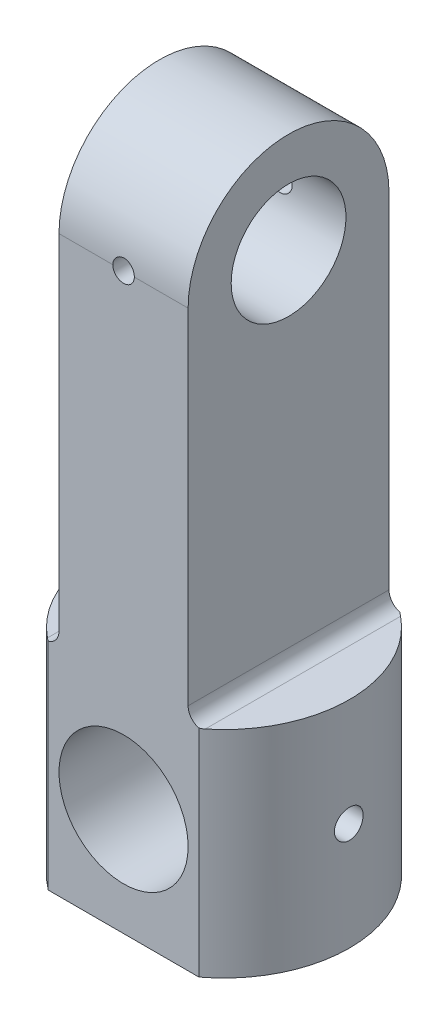
from build123d import *

# Parameters (mm, degrees)
SKETCH1_R               = 17.5
BOSS_EXTRUDE1_DEPTH     = 30
SKETCH2_W               = 18
SKETCH2_H               = 30.01666204
BOSS_EXTRUDE2_DEPTH     = 70
CUT_EXTRUDE1_DEPTH      = 104.01698889
CUT_EXTRUDE1_DEPTH_BACK = 104.01698889
CUT_EXTRUDE2_DEPTH      = 105.394683773
CUT_EXTRUDE2_DEPTH_BACK = 105.394683773
SKETCH4_R               = 8
CUT_EXTRUDE3_DEPTH      = 100.630567599
CUT_EXTRUDE3_DEPTH_BACK = 100.630567599
SKETCH6_R               = 9
FILLET1_R               = 2
CUT_EXTRUDE4_DEPTH      = 97.634621158
CUT_EXTRUDE4_DEPTH_BACK = 97.634621158
SKETCH7_R               = 2
CUT_EXTRUDE5_DEPTH      = 97.634621159
CUT_EXTRUDE5_DEPTH_BACK = 97.634621159
SKETCH8_R               = 1.5


with BuildPart() as part:
    # Sketch1 → Boss-Extrude1 (new body)
    with BuildSketch(Plane(origin=(0, 0, 0), x_dir=(1, 0, 0), z_dir=(0, 1, 0))):
        with Locations(Location((0, 0, 0), (0, 0, 270))):
            Circle(SKETCH1_R)
    extrude(amount=BOSS_EXTRUDE1_DEPTH)

    # Sketch2 → Boss-Extrude2 (add)
    with BuildSketch(Plane(origin=(0, 30, 0), x_dir=(1, 0, 0), z_dir=(0, 1, 0))):
        Rectangle(SKETCH2_W, SKETCH2_H)
    extrude(amount=BOSS_EXTRUDE2_DEPTH)

    # Sketch3 → Cut-Extrude1 (cut, two sides: drawn at the far end of the back side and taken through both)
    with BuildSketch(Plane.XZ.offset(-CUT_EXTRUDE1_DEPTH_BACK)):
        with BuildLine():
            Line((-10.5, -14), (10.5, -14))
            ThreePointArc((10.5, -14), (0, -17.5), (-10.5, -14))
        make_face()
        with BuildLine():
            Line((-10.5, 14), (10.5, 14))
            ThreePointArc((10.5, 14), (0, 17.5), (-10.5, 14))
        make_face()
    extrude(amount=CUT_EXTRUDE1_DEPTH + CUT_EXTRUDE1_DEPTH_BACK, mode=Mode.SUBTRACT)

    # Sketch4 → Cut-Extrude2 (cut, two sides: drawn at the far end of the back side and taken through both)
    with BuildSketch(Plane.ZY.offset(9).offset(-CUT_EXTRUDE2_DEPTH_BACK)):
        with Locations((0, 80)):
            Circle(SKETCH4_R)
        with BuildLine():
            Line((-14, 80), (-32.866525809, 80))
            Line((-32.866525809, 80), (-32.866525809, 110.116185887))
            Line((-32.866525809, 110.116185887), (25.904661095, 110.116185887))
            Line((25.904661095, 110.116185887), (25.904661095, 80))
            Line((25.904661095, 80), (14, 80))
            ThreePointArc((14, 80), (0, 94), (-14, 80))
        make_face()
    extrude(amount=CUT_EXTRUDE2_DEPTH + CUT_EXTRUDE2_DEPTH_BACK, mode=Mode.SUBTRACT)

    # Sketch6 → Cut-Extrude3 (cut, two sides: drawn at the far end of the back side and taken through both)
    with BuildSketch(Plane.XY.offset(-14).offset(-CUT_EXTRUDE3_DEPTH_BACK)):
        with Locations((0, 15)):
            Circle(SKETCH6_R)
    extrude(amount=CUT_EXTRUDE3_DEPTH + CUT_EXTRUDE3_DEPTH_BACK, mode=Mode.SUBTRACT)

    # Fillet1
    fillet1_edges = [part.edges().sort_by_distance(p)[0] for p in [
        (9, 30, 0),
        (-9, 30, 0),
    ]]
    fillet(fillet1_edges, radius=FILLET1_R)

    # Sketch7 → Cut-Extrude4 (cut, two sides: drawn at the far end of the back side and taken through both)
    with BuildSketch(Plane(origin=(0, 0, 0), x_dir=(0, 0, -1), z_dir=(1, 0, 0)).offset(-CUT_EXTRUDE4_DEPTH_BACK)):
        with Locations((0, 15)):
            Circle(SKETCH7_R)
    extrude(amount=CUT_EXTRUDE4_DEPTH + CUT_EXTRUDE4_DEPTH_BACK, mode=Mode.SUBTRACT)

    # Sketch8 → Cut-Extrude5 (cut, two sides: drawn at the far end of the back side and taken through both)
    with BuildSketch(Plane.XY.offset(-CUT_EXTRUDE5_DEPTH_BACK)):
        with Locations((0, 80)):
            Circle(SKETCH8_R)
    extrude(amount=CUT_EXTRUDE5_DEPTH + CUT_EXTRUDE5_DEPTH_BACK, mode=Mode.SUBTRACT)


solid = part.part
